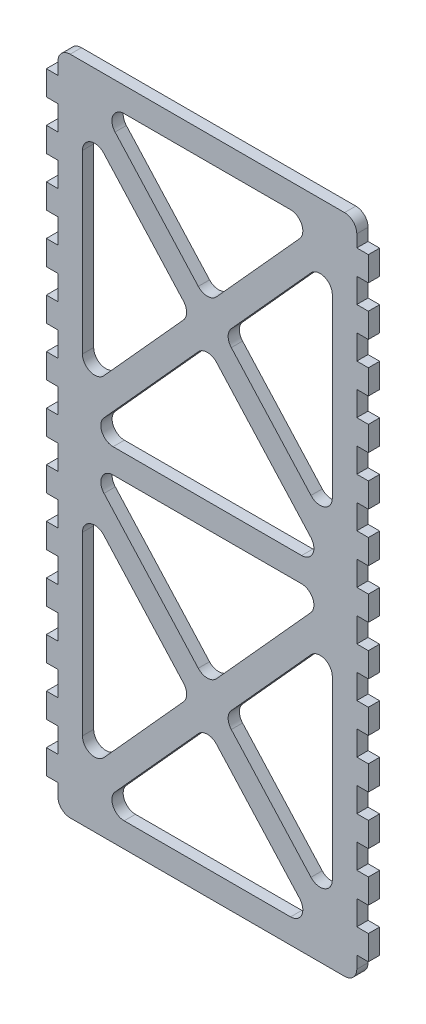
from build123d import *

# Parameters (mm, degrees)
SKETCH1_W                = 77.47
SKETCH1_H                = 171.45
BOSS_EXTRUDE1_DEPTH      = 1.4605
SKETCH3_W                = 2.921
SKETCH3_H                = 6.35
BOSS_EXTRUDE2_DEPTH      = 3
LPATTERN1_COUNT          = 13
LPATTERN1_PITCH          = 12.7
MIRROR1_COPY_1_SKETCH_W  = 2.921
MIRROR1_COPY_1_SKETCH_H  = 6.35
MIRROR1_COPY_1_DEPTH     = 3
MIRROR1_COPY_2_SKETCH_W  = 2.921
MIRROR1_COPY_2_SKETCH_H  = 6.35
MIRROR1_COPY_2_DEPTH     = 3
MIRROR1_COPY_3_SKETCH_W  = 2.921
MIRROR1_COPY_3_SKETCH_H  = 6.35
MIRROR1_COPY_3_DEPTH     = 3
MIRROR1_COPY_4_SKETCH_W  = 2.921
MIRROR1_COPY_4_SKETCH_H  = 6.35
MIRROR1_COPY_4_DEPTH     = 3
MIRROR1_COPY_5_SKETCH_W  = 2.921
MIRROR1_COPY_5_SKETCH_H  = 6.35
MIRROR1_COPY_5_DEPTH     = 3
MIRROR1_COPY_6_SKETCH_W  = 2.921
MIRROR1_COPY_6_SKETCH_H  = 6.35
MIRROR1_COPY_6_DEPTH     = 3
MIRROR1_COPY_7_SKETCH_W  = 2.921
MIRROR1_COPY_7_SKETCH_H  = 6.35
MIRROR1_COPY_7_DEPTH     = 3
MIRROR1_COPY_8_SKETCH_W  = 2.921
MIRROR1_COPY_8_SKETCH_H  = 6.35
MIRROR1_COPY_8_DEPTH     = 3
MIRROR1_COPY_9_SKETCH_W  = 2.921
MIRROR1_COPY_9_SKETCH_H  = 6.35
MIRROR1_COPY_9_DEPTH     = 3
MIRROR1_COPY_10_SKETCH_W = 2.921
MIRROR1_COPY_10_SKETCH_H = 6.35
MIRROR1_COPY_10_DEPTH    = 3
MIRROR1_COPY_11_SKETCH_W = 2.921
MIRROR1_COPY_11_SKETCH_H = 6.35
MIRROR1_COPY_11_DEPTH    = 3
MIRROR1_COPY_12_SKETCH_W = 2.921
MIRROR1_COPY_12_SKETCH_H = 6.35
MIRROR1_COPY_12_DEPTH    = 3
CUT_EXTRUDE1_DEPTH       = 96.389297571
FILLET1_R                = 3.175
FILLET2_R                = 3.175


with BuildPart() as part:
    # Sketch1 → Boss-Extrude1 (new, symmetric)
    with BuildSketch(Plane.XY):
        Rectangle(SKETCH1_W, SKETCH1_H)
    extrude(amount=BOSS_EXTRUDE1_DEPTH, both=True)

    # Sketch3 → Boss-Extrude2 (add)
    with BuildSketch(Plane.ZY.offset(38.735)):
        with Locations((0, -76.2)):
            Rectangle(SKETCH3_W, SKETCH3_H)
    boss_extrude2 = extrude(amount=BOSS_EXTRUDE2_DEPTH)

    # LPattern1: Boss-Extrude2 ×13
    with Locations(*[(0, i * LPATTERN1_PITCH, 0) for i in range(1, LPATTERN1_COUNT)]):
        add(boss_extrude2)

    # Mirror1: Boss-Extrude2 across plane
    add(boss_extrude2.mirror(Plane.ZY))

    # Mirror1 copy 1 sketch → Mirror1 copy 1 (add)
    with BuildSketch(Plane(origin=(38.735, 12.7, 0), x_dir=(0, 0, 1), z_dir=(1, 0, 0))):
        with Locations((0, 76.2)):
            Rectangle(MIRROR1_COPY_1_SKETCH_W, MIRROR1_COPY_1_SKETCH_H)
    extrude(amount=MIRROR1_COPY_1_DEPTH)

    # Mirror1 copy 2 sketch → Mirror1 copy 2 (add)
    with BuildSketch(Plane(origin=(38.735, 25.4, 0), x_dir=(0, 0, 1), z_dir=(1, 0, 0))):
        with Locations((0, 76.2)):
            Rectangle(MIRROR1_COPY_2_SKETCH_W, MIRROR1_COPY_2_SKETCH_H)
    extrude(amount=MIRROR1_COPY_2_DEPTH)

    # Mirror1 copy 3 sketch → Mirror1 copy 3 (add)
    with BuildSketch(Plane(origin=(38.735, 38.1, 0), x_dir=(0, 0, 1), z_dir=(1, 0, 0))):
        with Locations((0, 76.2)):
            Rectangle(MIRROR1_COPY_3_SKETCH_W, MIRROR1_COPY_3_SKETCH_H)
    extrude(amount=MIRROR1_COPY_3_DEPTH)

    # Mirror1 copy 4 sketch → Mirror1 copy 4 (add)
    with BuildSketch(Plane(origin=(38.735, 50.8, 0), x_dir=(0, 0, 1), z_dir=(1, 0, 0))):
        with Locations((0, 76.2)):
            Rectangle(MIRROR1_COPY_4_SKETCH_W, MIRROR1_COPY_4_SKETCH_H)
    extrude(amount=MIRROR1_COPY_4_DEPTH)

    # Mirror1 copy 5 sketch → Mirror1 copy 5 (add)
    with BuildSketch(Plane(origin=(38.735, 63.5, 0), x_dir=(0, 0, 1), z_dir=(1, 0, 0))):
        with Locations((0, 76.2)):
            Rectangle(MIRROR1_COPY_5_SKETCH_W, MIRROR1_COPY_5_SKETCH_H)
    extrude(amount=MIRROR1_COPY_5_DEPTH)

    # Mirror1 copy 6 sketch → Mirror1 copy 6 (add)
    with BuildSketch(Plane(origin=(38.735, 76.2, 0), x_dir=(0, 0, 1), z_dir=(1, 0, 0))):
        with Locations((0, 76.2)):
            Rectangle(MIRROR1_COPY_6_SKETCH_W, MIRROR1_COPY_6_SKETCH_H)
    extrude(amount=MIRROR1_COPY_6_DEPTH)

    # Mirror1 copy 7 sketch → Mirror1 copy 7 (add)
    with BuildSketch(Plane(origin=(38.735, 88.9, 0), x_dir=(0, 0, 1), z_dir=(1, 0, 0))):
        with Locations((0, 76.2)):
            Rectangle(MIRROR1_COPY_7_SKETCH_W, MIRROR1_COPY_7_SKETCH_H)
    extrude(amount=MIRROR1_COPY_7_DEPTH)

    # Mirror1 copy 8 sketch → Mirror1 copy 8 (add)
    with BuildSketch(Plane(origin=(38.735, 101.6, 0), x_dir=(0, 0, 1), z_dir=(1, 0, 0))):
        with Locations((0, 76.2)):
            Rectangle(MIRROR1_COPY_8_SKETCH_W, MIRROR1_COPY_8_SKETCH_H)
    extrude(amount=MIRROR1_COPY_8_DEPTH)

    # Mirror1 copy 9 sketch → Mirror1 copy 9 (add)
    with BuildSketch(Plane(origin=(38.735, 114.3, 0), x_dir=(0, 0, 1), z_dir=(1, 0, 0))):
        with Locations((0, 76.2)):
            Rectangle(MIRROR1_COPY_9_SKETCH_W, MIRROR1_COPY_9_SKETCH_H)
    extrude(amount=MIRROR1_COPY_9_DEPTH)

    # Mirror1 copy 10 sketch → Mirror1 copy 10 (add)
    with BuildSketch(Plane(origin=(38.735, 127, 0), x_dir=(0, 0, 1), z_dir=(1, 0, 0))):
        with Locations((0, 76.2)):
            Rectangle(MIRROR1_COPY_10_SKETCH_W, MIRROR1_COPY_10_SKETCH_H)
    extrude(amount=MIRROR1_COPY_10_DEPTH)

    # Mirror1 copy 11 sketch → Mirror1 copy 11 (add)
    with BuildSketch(Plane(origin=(38.735, 139.7, 0), x_dir=(0, 0, 1), z_dir=(1, 0, 0))):
        with Locations((0, 76.2)):
            Rectangle(MIRROR1_COPY_11_SKETCH_W, MIRROR1_COPY_11_SKETCH_H)
    extrude(amount=MIRROR1_COPY_11_DEPTH)

    # Mirror1 copy 12 sketch → Mirror1 copy 12 (add)
    with BuildSketch(Plane(origin=(38.735, 152.4, 0), x_dir=(0, 0, 1), z_dir=(1, 0, 0))):
        with Locations((0, 76.2)):
            Rectangle(MIRROR1_COPY_12_SKETCH_W, MIRROR1_COPY_12_SKETCH_H)
    extrude(amount=MIRROR1_COPY_12_DEPTH)

    # Sketch4 → Cut-Extrude1 (cut, through all)
    with BuildSketch(Plane.XY.offset(1.4605)):
        Polygon((0, 47.597902846), (28.717080391, 79.375), (-28.717080391, 79.375), align=None)
        Polygon((-32.385, 11.762042191), (-4.279401091, 42.8625), (-32.385, 73.962957809), align=None)
        Polygon((32.385, 73.962957809), (4.279401091, 42.8625), (32.385, 11.762042191), align=None)
        Polygon((31.58633965, 3.175), (0, 38.127097154), (-31.58633965, 3.175), align=None)
        Polygon((-31.58633965, -3.175), (0, -38.127097154), (31.58633965, -3.175), align=None)
        Polygon((-4.279401091, -42.8625), (-32.385, -11.762042191), (-32.385, -73.962957809), align=None)
        Polygon((28.717080391, -79.375), (0, -47.597902846), (-28.717080391, -79.375), align=None)
        Polygon((32.385, -73.962957809), (32.385, -11.762042191), (4.279401091, -42.8625), align=None)
    extrude(amount=-CUT_EXTRUDE1_DEPTH, mode=Mode.SUBTRACT)

    # Fillet1
    fillet1_edges = [part.edges().sort_by_distance(p)[0] for p in [
        (-31.58633965, -3.175, 0),
        (31.58633965, -3.175, 0),
        (0, -38.127097154, 0),
        (-31.58633965, 3.175, 0),
        (0, 38.127097154, 0),
        (31.58633965, 3.175, 0),
        (32.385, 73.962957809, 0),
        (32.385, 11.762042191, 0),
        (4.279401091, 42.8625, 0),
        (-32.385, 73.962957809, 0),
        (-4.279401091, 42.8625, 0),
        (-32.385, 11.762042191, 0),
        (32.385, -11.762042191, 0),
        (32.385, -73.962957809, 0),
        (4.279401091, -42.8625, 0),
        (-32.385, -11.762042191, 0),
        (-4.279401091, -42.8625, 0),
        (-32.385, -73.962957809, 0),
        (-28.717080391, -79.375, 0),
        (0, -47.597902846, 0),
        (28.717080391, -79.375, 0),
        (-28.717080391, 79.375, 0),
        (28.717080391, 79.375, 0),
        (0, 47.597902846, 0),
    ]]
    fillet(fillet1_edges, radius=FILLET1_R)

    # Fillet2
    fillet2_edges = [part.edges().sort_by_distance(p)[0] for p in [
        (-38.735, 85.725, 0),
        (38.735, 85.725, 0),
        (38.735, -85.725, 0),
        (-38.735, -85.725, 0),
    ]]
    fillet(fillet2_edges, radius=FILLET2_R)


solid = part.part
